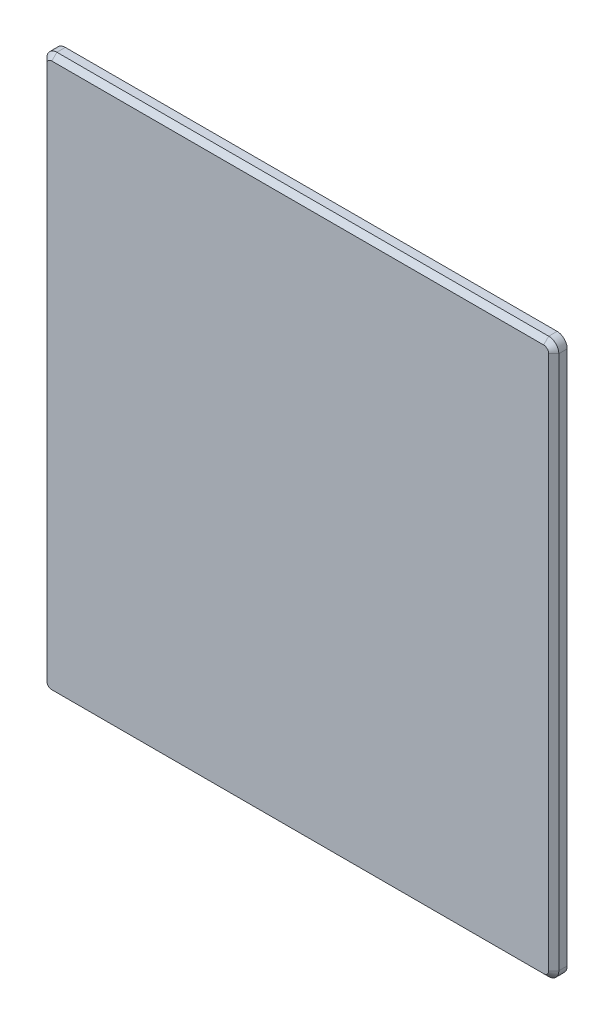
from build123d import *

# Parameters (mm, degrees)
ESBO_O1_W                = 152
ESBO_O1_H                = 164.64
RESSALTO_EXTRUS_O1_DEPTH = 4
FILETE1_R                = 3
RESSALTO_EXTRUS_O2_DEPTH = 4
FILETE2_R                = 3
FILETE3_R                = 1
CHANFRO1_SIZE            = 1.5
CHANFRO2_SIZE            = 1
ESBO_O3_R                = 2.1
CORTE_EXTRUS_O1_DEPTH    = 1


with BuildPart() as part:
    # Esboço1 → Ressalto-extrusão1 (new body)
    with BuildSketch(Plane.XY):
        Rectangle(ESBO_O1_W, ESBO_O1_H)
    extrude(amount=RESSALTO_EXTRUS_O1_DEPTH)

    # Filete1
    filete1_edges = [part.edges().sort_by_distance(p)[0] for p in [
        (76, -82.32, 2),
        (-76, -82.32, 2),
        (-76, 82.32, 2),
        (76, 82.32, 2),
    ]]
    fillet(filete1_edges, radius=FILETE1_R)

    # Esboço2 → Ressalto-extrusão2 (add)
    with BuildSketch(Plane(origin=(0, 0, 0), x_dir=(-1, 0, 0), z_dir=(0, 0, -1))):
        Polygon((-71.5, -73.32), (71.5, -73.32), (71.5, -40.35), (61, -40.35), (61, -35.35), (71.5, -35.35), (71.5, -21.68), (45, -21.68), (45, 56.32), (71.5, 56.32), (71.5, 77.82), (-71.5, 77.82), (-71.5, 56.32), (-45, 56.32), (-45, -21.68), (-71.5, -21.68), (-71.5, -35.35), (-61, -35.35), (-61, -40.35), (-71.5, -40.35), align=None)
    extrude(amount=RESSALTO_EXTRUS_O2_DEPTH)

    # Filete2
    filete2_edges = [part.edges().sort_by_distance(p)[0] for p in [
        (-71.5, 77.82, -2),
        (71.5, 77.82, -2),
        (45, 56.32, -2),
        (45, -21.68, -2),
        (71.5, -73.32, -2),
        (-71.5, -73.32, -2),
        (-45, -21.68, -2),
        (-45, 56.32, -2),
    ]]
    fillet(filete2_edges, radius=FILETE2_R)

    # Filete3
    filete3_edges = [part.edges().sort_by_distance(p)[0] for p in [
        (-71.5, 56.32, -2),
        (71.5, 56.32, -2),
        (71.5, -21.68, -2),
        (71.5, -35.35, -2),
        (61, -35.35, -2),
        (71.5, -40.35, -2),
        (-71.5, -40.35, -2),
        (-61, -35.35, -2),
        (-71.5, -35.35, -2),
        (-71.5, -21.68, -2),
    ]]
    fillet(filete3_edges, radius=FILETE3_R)

    # Chanfro1
    chanfro1_edges = [part.edges().sort_by_distance(p)[0] for p in [
        (-76, 0, 4),
        (0, 82.32, 4),
        (76, 0, 4),
        (0, -82.32, 4),
        (75.121320344, 81.441320344, 4),
        (75.121320344, -81.441320344, 4),
        (-75.121320344, -81.441320344, 4),
        (-75.121320344, 81.441320344, 4),
    ]]
    chamfer(chanfro1_edges, length=CHANFRO1_SIZE)

    # Chanfro2
    chanfro2_edges = [part.edges().sort_by_distance(p)[0] for p in [
        (71.5, 66.07, -4),
        (0, 77.82, -4),
        (45, 17.32, -4),
        (59.25, -21.68, -4),
        (0, -73.32, -4),
        (-71.5, -55.835, -4),
        (-45, 17.32, -4),
        (-59.25, 56.32, -4),
        (70.621320344, -72.441320344, -4),
        (-70.621320344, -72.441320344, -4),
        (-70.621320344, 76.941320344, -4),
        (70.621320344, 76.941320344, -4),
        (45.878679656, 55.441320344, -4),
        (45.878679656, -20.801320344, -4),
        (-45.878679656, -20.801320344, -4),
        (-45.878679656, 55.441320344, -4),
        (-65.75, -40.35, -4),
        (59.25, 56.32, -4),
        (71.5, -28.515, -4),
        (66.25, -35.35, -4),
        (61, -38.35, -4),
        (71.5, -55.835, -4),
        (-66.25, -35.35, -4),
        (-71.5, -28.515, -4),
        (-59.25, -21.68, -4),
        (-71.5, 66.07, -4),
        (71.207106781, -35.057106781, -4),
        (71.207106781, -21.972893219, -4),
        (71.207106781, 56.612893219, -4),
        (-71.207106781, 56.612893219, -4),
        (-71.207106781, -21.972893219, -4),
        (-71.207106781, -35.057106781, -4),
        (71.207106781, -40.642893219, -4),
        (-71.207106781, -40.642893219, -4),
        (-61.292893219, -35.642893219, -4),
        (61.292893219, -35.642893219, -4),
        (65.75, -40.35, -4),
        (-61, -38.35, -4),
    ]]
    chamfer(chanfro2_edges, length=CHANFRO2_SIZE)

    # Esboço3 → Corte-extrusão1 (cut)
    with BuildSketch(Plane(origin=(0, 0, 0), x_dir=(-1, 0, 0), z_dir=(0, 0, -1))):
        with Locations((-68, 48.32)):
            Circle(ESBO_O3_R)
        with Locations((-68, -11.68)):
            Circle(ESBO_O3_R)
        with Locations((-68, 18.32)):
            Circle(ESBO_O3_R)
        with Locations(Location((68, 18.32, 0), (0, 0, 180))):
            Circle(ESBO_O3_R)
        with Locations(Location((68, -11.68, 0), (0, 0, 180))):
            Circle(ESBO_O3_R)
        with Locations(Location((68, 48.32, 0), (0, 0, 180))):
            Circle(ESBO_O3_R)
    extrude(amount=-CORTE_EXTRUS_O1_DEPTH, mode=Mode.SUBTRACT)


solid = part.part
